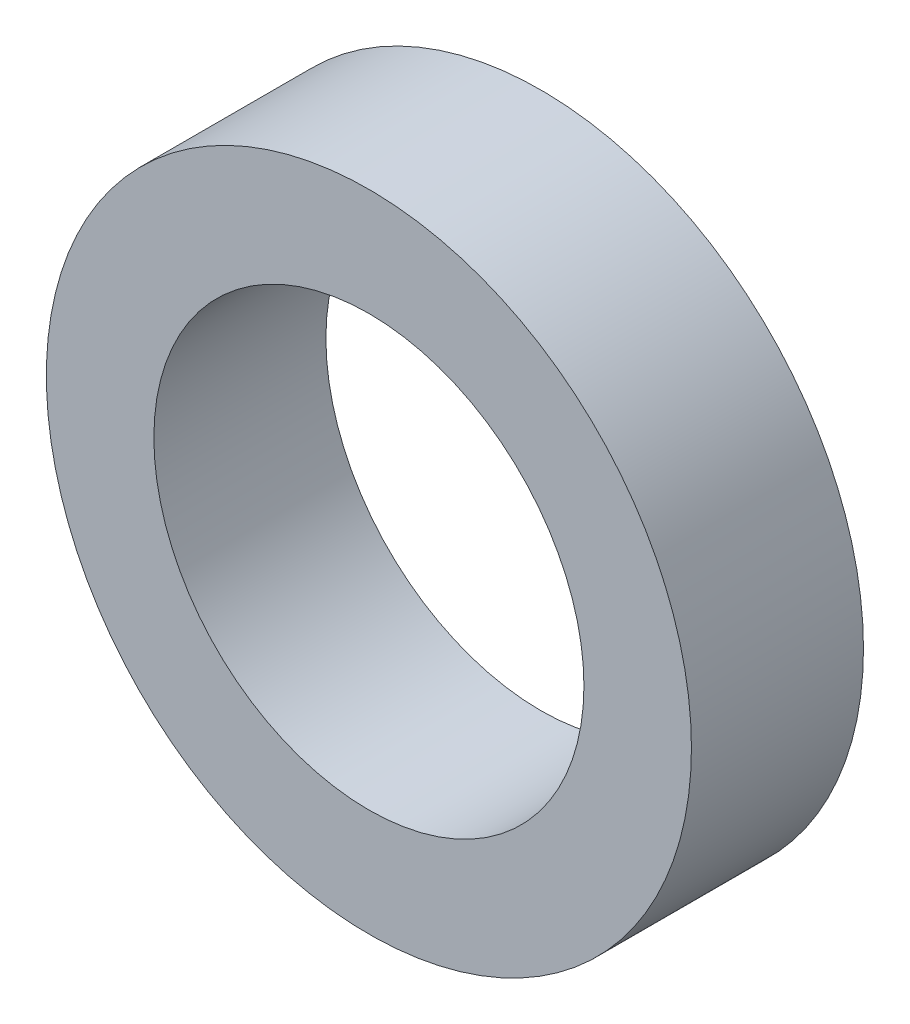
from build123d import *

# Parameters (mm, degrees)
ESQUISSE1_R        = 7.5
ESQUISSE1_R_2      = 5
BOSS_EXTRU_1_DEPTH = 2


with BuildPart() as part:
    # Esquisse1 → Boss.-Extru.1 (new, symmetric)
    with BuildSketch(Plane.XY):
        Circle(ESQUISSE1_R)
        Circle(ESQUISSE1_R_2, mode=Mode.SUBTRACT)
    extrude(amount=BOSS_EXTRU_1_DEPTH, both=True)


solid = part.part
